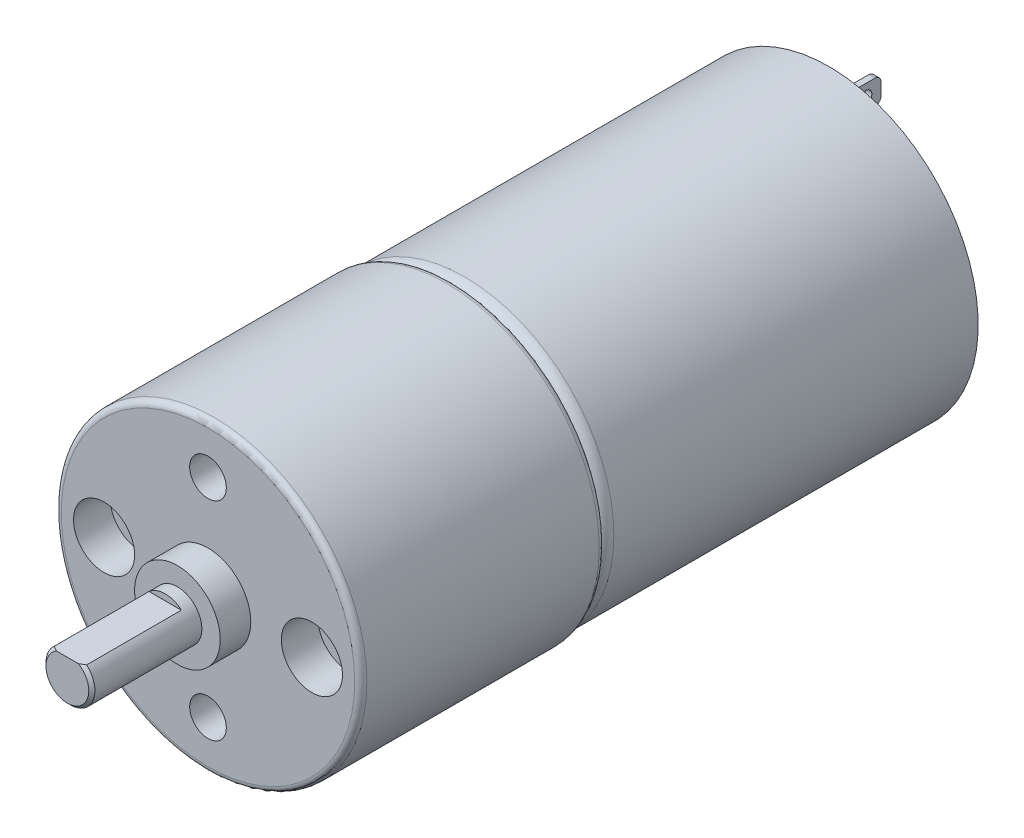
from build123d import *

# Parameters (mm, degrees)
SKETCH1_R            = 12.2
BOSS_EXTRUDE1_DEPTH  = 30.8
FILLET1_R            = 1
SKETCH2_R            = 3.25
BOSS_EXTRUDE2_DEPTH  = 2
SKETCH3_W            = 0.5
SKETCH3_H            = 2
BOSS_EXTRUDE4_DEPTH  = 4
SKETCH5_R            = 0.5
CUT_EXTRUDE2_DEPTH   = 4
FILLET3_R            = 0.5
FILLET3_OF_MIRROR2_R = 0.5
SKETCH6_R            = 12.5
BOSS_EXTRUDE5_DEPTH  = 20
FILLET4_R            = 0.5
SKETCH7_R            = 3.5
BOSS_EXTRUDE6_DEPTH  = 2.5
SKETCH8_R            = 2
BOSS_EXTRUDE7_DEPTH  = 9
CUT_EXTRUDE3_START   = -8
CUT_EXTRUDE3_DEPTH   = 8
CHAMFER1_SIZE        = 0.5
SKETCH11_R           = 1.5
CUT_EXTRUDE4_DEPTH   = 3.5
SKETCH12_R           = 2.5
CUT_EXTRUDE5_DEPTH   = 3
SKETCH13_R           = 1.25
CUT_EXTRUDE6_DEPTH   = 3.5
CHAMFER2_SIZE        = 0.25


with BuildPart() as part:
    # Sketch1 → Boss-Extrude1 (new body)
    with BuildSketch(Plane.XY):
        with Locations(Location((0, 0, 0), (0, 0, 180))):
            Circle(SKETCH1_R)
    extrude(amount=BOSS_EXTRUDE1_DEPTH)

    # Fillet1
    fillet1_edges = [part.edges().sort_by_distance(p)[0] for p in [
        (12.2, 0, 30.8),
    ]]
    fillet(fillet1_edges, radius=FILLET1_R)

    # Sketch2 → Boss-Extrude2 (add)
    with BuildSketch(Plane(origin=(0, 0, 0), x_dir=(-1, 0, 0), z_dir=(0, 0, -1))):
        Circle(SKETCH2_R)
    extrude(amount=BOSS_EXTRUDE2_DEPTH)

    # Sketch3 → Boss-Extrude4 (add)
    with BuildSketch(Plane(origin=(0, 0, 0), x_dir=(-1, 0, 0), z_dir=(0, 0, -1))):
        with Locations((0, 8.75)):
            Rectangle(SKETCH3_W, SKETCH3_H)
    boss_extrude4 = extrude(amount=BOSS_EXTRUDE4_DEPTH)

    # Sketch5 → Cut-Extrude2 (cut)
    with BuildSketch(Plane.ZY.offset(0.25)):
        with Locations(Location((-2.75, 8.75, 0), (0, 0, 270))):
            Circle(SKETCH5_R)
    cut_extrude2 = extrude(amount=-CUT_EXTRUDE2_DEPTH, mode=Mode.SUBTRACT)

    # Fillet3
    fillet3_edges = [part.edges().sort_by_distance(p)[0] for p in [
        (0, 9.75, -4),
        (0, 7.75, -4),
    ]]
    fillet(fillet3_edges, radius=FILLET3_R)

    # Mirror2: Boss-Extrude4, Cut-Extrude2 across plane
    add(boss_extrude4.mirror(Plane.ZX))
    add(cut_extrude2.mirror(Plane.ZX), mode=Mode.SUBTRACT)

    # Fillet3 of Mirror2
    fillet3_of_mirror2_edges = [part.edges().sort_by_distance(p)[0] for p in [
        (0, -9.75, -4),
        (0, -7.75, -4),
    ]]
    fillet(fillet3_of_mirror2_edges, radius=FILLET3_OF_MIRROR2_R)

    # Sketch6 → Boss-Extrude5 (add)
    with BuildSketch(Plane.XY.offset(30.8)):
        Circle(SKETCH6_R)
    extrude(amount=BOSS_EXTRUDE5_DEPTH)

    # Fillet4
    fillet4_edges = [part.edges().sort_by_distance(p)[0] for p in [
        (-12.5, 0, 30.8),
        (-12.5, 0, 50.8),
    ]]
    fillet(fillet4_edges, radius=FILLET4_R)

    # Sketch7 → Boss-Extrude6 (add)
    with BuildSketch(Plane.XY.offset(50.8)):
        Circle(SKETCH7_R)
    extrude(amount=BOSS_EXTRUDE6_DEPTH)

    # Sketch8 → Boss-Extrude7 (add)
    with BuildSketch(Plane.XY.offset(53.3)):
        Circle(SKETCH8_R)
    extrude(amount=BOSS_EXTRUDE7_DEPTH)

    # Sketch10 → Cut-Extrude3 (cut)
    with BuildSketch(Plane.XY.offset(62.3).offset(CUT_EXTRUDE3_START)):
        with BuildLine():
            Line((1.322875656, 1.5), (-1.322875656, 1.5))
            ThreePointArc((-1.322875656, 1.5), (0, 2), (1.322875656, 1.5))
        make_face()
    extrude(amount=CUT_EXTRUDE3_DEPTH, mode=Mode.SUBTRACT)

    # Chamfer1
    chamfer1_edges = [part.edges().sort_by_distance(p)[0] for p in [
        (3.25, 0, -2),
    ]]
    chamfer(chamfer1_edges, length=CHAMFER1_SIZE)

    # Sketch11 → Cut-Extrude4 (cut)
    with BuildSketch(Plane.XY.offset(50.8)):
        with Locations((0, -8.5)):
            Circle(SKETCH11_R)
        with Locations((0, 8.5)):
            Circle(SKETCH11_R)
    extrude(amount=-CUT_EXTRUDE4_DEPTH, mode=Mode.SUBTRACT)

    # Sketch12 → Cut-Extrude5 (cut)
    with BuildSketch(Plane.XY.offset(50.8)):
        with Locations((-8.5, 0)):
            Circle(SKETCH12_R)
        with Locations((8.5, 0)):
            Circle(SKETCH12_R)
    extrude(amount=-CUT_EXTRUDE5_DEPTH, mode=Mode.SUBTRACT)

    # Sketch13 → Cut-Extrude6 (cut)
    with BuildSketch(Plane.XY.offset(47.8)):
        with Locations((8.5, 0)):
            Circle(SKETCH13_R)
        with Locations((-8.5, 0)):
            Circle(SKETCH13_R)
    extrude(amount=-CUT_EXTRUDE6_DEPTH, mode=Mode.SUBTRACT)

    # Chamfer2
    chamfer2_edges = [part.edges().sort_by_distance(p)[0] for p in [
        (-0.822875656, -1.822875656, 62.3),
    ]]
    chamfer(chamfer2_edges, length=CHAMFER2_SIZE)


solid = part.part
